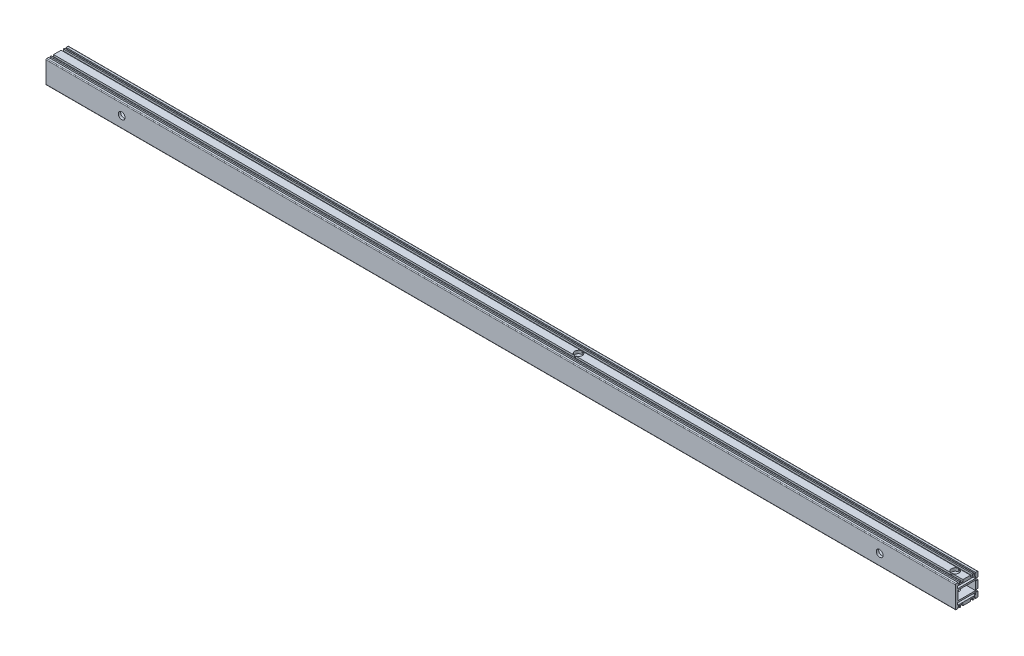
from build123d import *

# Parameters (mm, degrees)
SKETCH_1_W             = 23.5
SKETCH_1_H             = 12
EXTRUDE_1_DEPTH        = 601
HOLE_WIZARD_M6_1_D     = 5
HOLE_WIZARD_M6_1_DEPTH = 15
HOLE_WIZARD_M6_1_TIP   = 1.502151548
HOLE_WIZARD_M6_2_D     = 5
HOLE_WIZARD_M6_2_DEPTH = 15
HOLE_WIZARD_M6_2_TIP   = 1.502151548
SKETCH_6_R             = 5.05
CUT_EXTRUDE_1_DEPTH    = 602.935212461
HOLE_WIZARD_M4_1_D     = 3.3
HOLE_WIZARD_M4_1_DEPTH = 10.1
HOLE_WIZARD_M4_1_TIP   = 0.991420021
SKETCH_10_R            = 4.5
CUT_EXTRUDE_2_DEPTH    = 602.935212461
HOLE_WIZARD_M4_2_D     = 3.3
HOLE_WIZARD_M4_2_DEPTH = 10.1
HOLE_WIZARD_M4_2_TIP   = 0.991420021


with BuildPart() as part:
    # 草图1 → 凸台-拉伸1 (new, symmetric)
    with BuildSketch(Plane(origin=(0, 0, 0), x_dir=(0, 0, -1), z_dir=(1, 0, 0))):
        with BuildLine():
            Line((-14, 15), (-11.5, 15))
            Line((-11.5, 15), (-11.5, 13.5))
            Line((-11.5, 13.5), (-11.4, 13.5))
            ThreePointArc((-11.4, 13.5), (-11.117157288, 13.382842712), (-11, 13.1))
            Line((-11, 13.1), (-11, 12))
            Line((-11, 12), (-9.5, 12))
            Line((-9.5, 12), (-9.5, 15))
            Line((-9.5, 15), (-8, 15))
            Line((-8, 15), (-8, 12.5))
            Line((-8, 12.5), (-5, 12.5))
            Line((-5, 12.5), (-5, 15))
            Line((-5, 15), (5, 15))
            Line((5, 15), (5, 12.5))
            Line((5, 12.5), (8, 12.5))
            Line((8, 12.5), (8, 15))
            Line((8, 15), (9.5, 15))
            Line((9.5, 15), (9.5, 12))
            Line((9.5, 12), (11, 12))
            Line((11, 12), (11, 13.1))
            ThreePointArc((11, 13.1), (11.117157288, 13.382842712), (11.4, 13.5))
            Line((11.4, 13.5), (11.5, 13.5))
            Line((11.5, 13.5), (11.5, 15))
            Line((11.5, 15), (14, 15))
            ThreePointArc((14, 15), (14.707106781, 14.707106781), (15, 14))
            Line((15, 14), (15, 8))
            Line((15, 8), (12.5, 8))
            Line((12.5, 8), (12.5, 5))
            Line((12.5, 5), (15, 5))
            Line((15, 5), (15, -5))
            Line((15, -5), (12.5, -5))
            Line((12.5, -5), (12.5, -8))
            Line((12.5, -8), (15, -8))
            Line((15, -8), (15, -14))
            ThreePointArc((15, -14), (14.707106781, -14.707106781), (14, -15))
            Line((14, -15), (11.5, -15))
            Line((11.5, -15), (11.5, -13.5))
            Line((11.5, -13.5), (11.4, -13.5))
            ThreePointArc((11.4, -13.5), (11.117157288, -13.382842712), (11, -13.1))
            Line((11, -13.1), (11, -12))
            Line((11, -12), (9.5, -12))
            Line((9.5, -12), (9.5, -15))
            Line((9.5, -15), (8, -15))
            Line((8, -15), (8, -12.5))
            Line((8, -12.5), (5, -12.5))
            Line((5, -12.5), (5, -15))
            Line((5, -15), (-5, -15))
            Line((-5, -15), (-5, -12.5))
            Line((-5, -12.5), (-8, -12.5))
            Line((-8, -12.5), (-8, -15))
            Line((-8, -15), (-9.5, -15))
            Line((-9.5, -15), (-9.5, -12))
            Line((-9.5, -12), (-11, -12))
            Line((-11, -12), (-11, -13.1))
            ThreePointArc((-11, -13.1), (-11.117157288, -13.382842712), (-11.4, -13.5))
            Line((-11.4, -13.5), (-11.5, -13.5))
            Line((-11.5, -13.5), (-11.5, -15))
            Line((-11.5, -15), (-14, -15))
            ThreePointArc((-14, -15), (-14.707106781, -14.707106781), (-15, -14))
            Line((-15, -14), (-15, 14))
            ThreePointArc((-15, 14), (-14.707106781, 14.707106781), (-14, 15))
        make_face()
        with BuildLine():
            Line((12, -10.5), (12, -8.5))
            ThreePointArc((12, -8.5), (11.853553391, -8.146446609), (11.5, -8))
            Line((11.5, -8), (-11.5, -8))
            ThreePointArc((-11.5, -8), (-11.853553391, -8.146446609), (-12, -8.5))
            Line((-12, -8.5), (-12, -10.5))
            ThreePointArc((-12, -10.5), (-11.853553391, -10.853553391), (-11.5, -11))
            Line((-11.5, -11), (11.5, -11))
            ThreePointArc((11.5, -11), (11.853553391, -10.853553391), (12, -10.5))
        make_face(mode=Mode.SUBTRACT)
        with BuildLine():
            Line((-11.5, 11), (11.5, 11))
            ThreePointArc((11.5, 11), (11.853553391, 10.853553391), (12, 10.5))
            Line((12, 10.5), (12, 8.5))
            ThreePointArc((12, 8.5), (11.853553391, 8.146446609), (11.5, 8))
            Line((11.5, 8), (-11.5, 8))
            ThreePointArc((-11.5, 8), (-11.853553391, 8.146446609), (-12, 8.5))
            Line((-12, 8.5), (-12, 10.5))
            ThreePointArc((-12, 10.5), (-11.853553391, 10.853553391), (-11.5, 11))
        make_face(mode=Mode.SUBTRACT)
        Rectangle(SKETCH_1_W, SKETCH_1_H, mode=Mode.SUBTRACT)
    extrude(amount=EXTRUDE_1_DEPTH, both=True)

    # M6 螺纹孔1
    with Locations(Plane(origin=(0, 0, -15), x_dir=(-1, 0, 0), z_dir=(0, 0, -1))):
        with Locations((-551, 0), (-536, 0), (536, 0), (551, 0)):
            Hole(HOLE_WIZARD_M6_1_D / 2, depth=HOLE_WIZARD_M6_1_DEPTH)
            with Locations((0, 0, -(HOLE_WIZARD_M6_1_DEPTH + HOLE_WIZARD_M6_1_TIP / 2))):  # 118° drill point
                Cone(0, HOLE_WIZARD_M6_1_D / 2, HOLE_WIZARD_M6_1_TIP, mode=Mode.SUBTRACT)

    # M6 螺纹孔2
    with Locations(Plane.XZ.offset(15)):
        with Locations((551, 0), (536, 0), (-199, 0), (-214, 0), (-284, 0), (-299, 0), (-536, 0), (-551, 0)):
            Hole(HOLE_WIZARD_M6_2_D / 2, depth=HOLE_WIZARD_M6_2_DEPTH)
            with Locations((0, 0, -(HOLE_WIZARD_M6_2_DEPTH + HOLE_WIZARD_M6_2_TIP / 2))):  # 118° drill point
                Cone(0, HOLE_WIZARD_M6_2_D / 2, HOLE_WIZARD_M6_2_TIP, mode=Mode.SUBTRACT)

    # 草图6 → 切除-拉伸1 (cut, through all)
    with BuildSketch(Plane.XZ.offset(15)):
        with Locations(Location((88, 0, 0), (0, 0, 90))):
            Circle(SKETCH_6_R)
        with Locations(Location((586, 0, 0), (0, 0, 90))):
            Circle(SKETCH_6_R)
    extrude(amount=-CUT_EXTRUDE_1_DEPTH, mode=Mode.SUBTRACT)

    # M4 螺纹孔1
    with Locations(Plane.XZ.offset(15)):
        with Locations((489, 0), (329, 0), (169, 0), (9, 0), (-151, 0)):
            Hole(HOLE_WIZARD_M4_1_D / 2, depth=HOLE_WIZARD_M4_1_DEPTH)
            with Locations((0, 0, -(HOLE_WIZARD_M4_1_DEPTH + HOLE_WIZARD_M4_1_TIP / 2))):  # 118° drill point
                Cone(0, HOLE_WIZARD_M4_1_D / 2, HOLE_WIZARD_M4_1_TIP, mode=Mode.SUBTRACT)

    # 草图10 → 切除-拉伸2 (cut, through all)
    with BuildSketch(Plane.XY.offset(15)):
        with Locations((-501, 0)):
            Circle(SKETCH_10_R)
        with Locations((501, 0)):
            Circle(SKETCH_10_R)
    extrude(amount=-CUT_EXTRUDE_2_DEPTH, mode=Mode.SUBTRACT)

    # M4 螺纹孔2
    with Locations(Plane(origin=(0, 0, -15), x_dir=(-1, 0, 0), z_dir=(0, 0, -1))):
        with Locations((-479, 0), (-319, 0), (-159, 0), (1, 0), (161, 0), (321, 0), (481, 0)):
            Hole(HOLE_WIZARD_M4_2_D / 2, depth=HOLE_WIZARD_M4_2_DEPTH)
            with Locations((0, 0, -(HOLE_WIZARD_M4_2_DEPTH + HOLE_WIZARD_M4_2_TIP / 2))):  # 118° drill point
                Cone(0, HOLE_WIZARD_M4_2_D / 2, HOLE_WIZARD_M4_2_TIP, mode=Mode.SUBTRACT)


solid = part.part
